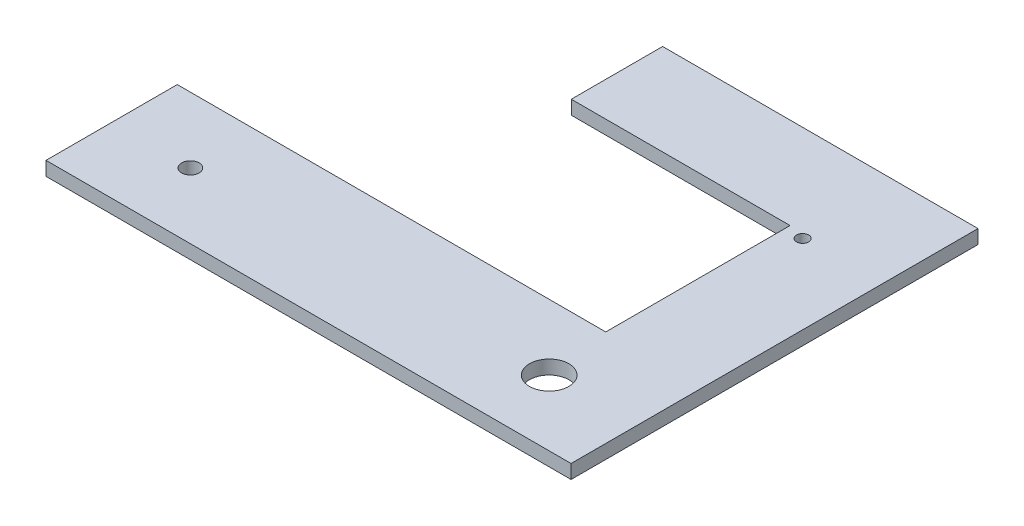
from build123d import *

# Parameters (mm, degrees)
SKETCH1_W           = 120
SKETCH1_H           = 30
BOSS_EXTRUDE1_DEPTH = 3.175
SKETCH2_R           = 2
SKETCH2_R_2         = 4.5
CUT_EXTRUDE1_DEPTH  = 3.175
SKETCH3_W           = 22.072613883
SKETCH3_H           = 3.175
BOSS_EXTRUDE2_DEPTH = 63
SKETCH4_R           = 1.381817411
CUT_EXTRUDE2_DEPTH  = 10
SKETCH5_W           = 20.875808172
SKETCH5_H           = 3.175
BOSS_EXTRUDE3_DEPTH = 50


with BuildPart() as part:
    # Sketch1 → Boss-Extrude1 (new body)
    with BuildSketch(Plane(origin=(0, 0, 0), x_dir=(1, 0, 0), z_dir=(0, 1, 0))):
        with Locations((60, 15)):
            Rectangle(SKETCH1_W, SKETCH1_H)
    extrude(amount=BOSS_EXTRUDE1_DEPTH)

    # Sketch2 → Cut-Extrude1 (cut)
    with BuildSketch(Plane(origin=(0, 3.175, 0), x_dir=(1, 0, 0), z_dir=(0, 1, 0))):
        with Locations(Location((18, 15, 0), (0, 0, 270))):
            Circle(SKETCH2_R)
        with Locations(Location((100, 15, 0), (0, 0, 270))):
            Circle(SKETCH2_R_2)
    extrude(amount=-CUT_EXTRUDE1_DEPTH, mode=Mode.SUBTRACT)

    # Sketch3 → Boss-Extrude2 (add)
    with BuildSketch(Plane(origin=(0, 0, -30), x_dir=(-1, 0, 0), z_dir=(0, 0, -1))):
        with Locations((-108.963693059, 1.5875)):
            Rectangle(SKETCH3_W, SKETCH3_H)
    extrude(amount=BOSS_EXTRUDE2_DEPTH)

    # Sketch4 → Cut-Extrude2 (cut)
    with BuildSketch(Plane(origin=(0, 3.175, 0), x_dir=(1, 0, 0), z_dir=(0, 1, 0))):
        with Locations(Location((101.927386117, 71, 0), (0, 0, 270))):
            Circle(SKETCH4_R)
    extrude(amount=-CUT_EXTRUDE2_DEPTH, mode=Mode.SUBTRACT)

    # Sketch5 → Boss-Extrude3 (add)
    with BuildSketch(Plane.ZY.offset(-97.927386117)):
        with Locations((-82.562095914, 1.5875)):
            Rectangle(SKETCH5_W, SKETCH5_H)
    extrude(amount=BOSS_EXTRUDE3_DEPTH)


solid = part.part
